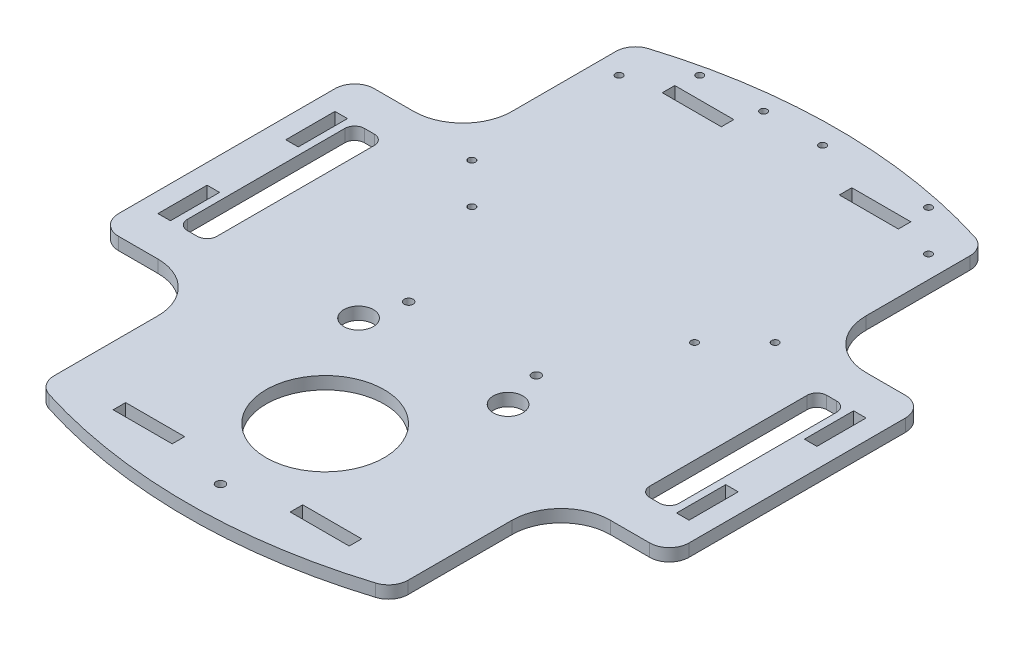
from build123d import *

# Parameters (mm, degrees)
ESQUISSE1_W             = 180
ESQUISSE1_H             = 300
ESQUISSE1_W_2           = 55
ESQUISSE1_H_2           = 130
BOSS_EXTRU_1_DEPTH      = 6.35
CONG_1_R                = 25
CONG_2_R                = 10
ENL_V_MAT_EXTRU_1_REACH = 221.751
ESQUISSE2_R             = 30
ENL_V_MAT_EXTRU_2_REACH = 221.751
ESQUISSE3_R             = 2.25
ENL_V_MAT_EXTRU_3_REACH = 221.751
ESQUISSE5_W             = 30
ESQUISSE5_H             = 6.35
ESQUISSE5_W_2           = 6.35
ESQUISSE5_H_2           = 25
ENL_V_MAT_EXTRU_4_REACH = 221.751
ESQUISSE6_R             = 7.5
ENL_V_MAT_EXTRU_5_REACH = 221.751
ENL_V_MAT_EXTRU_6_REACH = 221.751
ESQUISSE8_R             = 1.8


with BuildPart() as part:
    # Esquisse1 → Boss.-Extru.1 (new body)
    with BuildSketch(Plane(origin=(0, 0, 0), x_dir=(1, 0, 0), z_dir=(0, 1, 0))):
        Rectangle(ESQUISSE1_W, ESQUISSE1_H)
        with Locations((-117.5, 0)):
            Rectangle(ESQUISSE1_W_2, ESQUISSE1_H_2)
        with Locations((117.5, 0)):
            Rectangle(ESQUISSE1_W_2, ESQUISSE1_H_2)
        with BuildLine():
            Line((-90, -150), (90, -150))
            ThreePointArc((90, -150), (0, -165), (-90, -150))
        make_face()
        with BuildLine():
            ThreePointArc((-90, 150), (0, 165), (90, 150))
            Line((90, 150), (-90, 150))
        make_face()
    extrude(amount=BOSS_EXTRU_1_DEPTH)

    # Congé1
    cong_1_edges = [part.edges().sort_by_distance(p)[0] for p in [
        (-90, 3.175, 65),
        (-90, 3.175, -65),
        (90, 3.175, -65),
        (90, 3.175, 65),
    ]]
    fillet(cong_1_edges, radius=CONG_1_R)

    # Congé2
    cong_2_edges = [part.edges().sort_by_distance(p)[0] for p in [
        (-145, 3.175, 65),
        (-145, 3.175, -65),
        (-90, 3.175, -150),
        (90, 3.175, -150),
        (145, 3.175, -65),
        (145, 3.175, 65),
        (90, 3.175, 150),
        (-90, 3.175, 150),
    ]]
    fillet(cong_2_edges, radius=CONG_2_R)

    # Esquisse2 → Enlèv. mat.-Extru.1 (cut, up to next)
    with BuildSketch(Plane(origin=(0, 6.35, 0), x_dir=(1, 0, 0), z_dir=(0, 1, 0)), mode=Mode.PRIVATE) as enl_v_mat_extru_1_sk1:
        with Locations(Location((0, -95, 0), (0, 0, 270))):
            Circle(ESQUISSE2_R)
    enl_v_mat_extru_1_tool1 = extrude(enl_v_mat_extru_1_sk1.sketch, amount=-ENL_V_MAT_EXTRU_1_REACH, mode=Mode.PRIVATE) & part.part
    add(enl_v_mat_extru_1_tool1.solids().sort_by_distance((0, 6.35, 95))[0], mode=Mode.SUBTRACT)

    # Esquisse3 → Enlèv. mat.-Extru.2 (cut, up to next)
    with BuildSketch(Plane(origin=(0, 6.35, 0), x_dir=(1, 0, 0), z_dir=(0, 1, 0)), mode=Mode.PRIVATE) as enl_v_mat_extru_2_sk1:
        with Locations(Location((-32.430740144, -20.063884254, 0), (0, 0, 270))):
            Circle(ESQUISSE3_R)
    enl_v_mat_extru_2_tool1 = extrude(enl_v_mat_extru_2_sk1.sketch, amount=-ENL_V_MAT_EXTRU_2_REACH, mode=Mode.PRIVATE) & part.part
    # Esquisse3 → Enlèv. mat.-Extru.2 (cut, up to next)
    with BuildSketch(Plane(origin=(0, 6.35, 0), x_dir=(1, 0, 0), z_dir=(0, 1, 0)), mode=Mode.PRIVATE) as enl_v_mat_extru_2_sk2:
        with Locations(Location((32.430740144, -20.063884254, 0), (0, 0, 270))):
            Circle(ESQUISSE3_R)
    enl_v_mat_extru_2_tool2 = extrude(enl_v_mat_extru_2_sk2.sketch, amount=-ENL_V_MAT_EXTRU_2_REACH, mode=Mode.PRIVATE) & part.part
    # Esquisse3 → Enlèv. mat.-Extru.2 (cut, up to next)
    with BuildSketch(Plane(origin=(0, 6.35, 0), x_dir=(1, 0, 0), z_dir=(0, 1, 0)), mode=Mode.PRIVATE) as enl_v_mat_extru_2_sk3:
        with Locations(Location((0, -148.187083331, 0), (0, 0, 270))):
            Circle(ESQUISSE3_R)
    enl_v_mat_extru_2_tool3 = extrude(enl_v_mat_extru_2_sk3.sketch, amount=-ENL_V_MAT_EXTRU_2_REACH, mode=Mode.PRIVATE) & part.part
    add(enl_v_mat_extru_2_tool1.solids().sort_by_distance((-32.43074, 6.35, 20.063884))[0], mode=Mode.SUBTRACT)
    add(enl_v_mat_extru_2_tool2.solids().sort_by_distance((32.43074, 6.35, 20.063884))[0], mode=Mode.SUBTRACT)
    add(enl_v_mat_extru_2_tool3.solids().sort_by_distance((0, 6.35, 148.187083))[0], mode=Mode.SUBTRACT)

    # Esquisse5 → Enlèv. mat.-Extru.3 (cut, up to next)
    with BuildSketch(Plane(origin=(0, 6.35, 0), x_dir=(1, 0, 0), z_dir=(0, 1, 0)), mode=Mode.PRIVATE) as enl_v_mat_extru_3_sk1:
        with Locations((-45, 139.582223208)):
            Rectangle(ESQUISSE5_W, ESQUISSE5_H)
    enl_v_mat_extru_3_tool1 = extrude(enl_v_mat_extru_3_sk1.sketch, amount=-ENL_V_MAT_EXTRU_3_REACH, mode=Mode.PRIVATE) & part.part
    # Esquisse5 → Enlèv. mat.-Extru.3 (cut, up to next)
    with BuildSketch(Plane(origin=(0, 6.35, 0), x_dir=(1, 0, 0), z_dir=(0, 1, 0)), mode=Mode.PRIVATE) as enl_v_mat_extru_3_sk2:
        with Locations((45, 139.582223208)):
            Rectangle(ESQUISSE5_W, ESQUISSE5_H)
    enl_v_mat_extru_3_tool2 = extrude(enl_v_mat_extru_3_sk2.sketch, amount=-ENL_V_MAT_EXTRU_3_REACH, mode=Mode.PRIVATE) & part.part
    # Esquisse5 → Enlèv. mat.-Extru.3 (cut, up to next)
    with BuildSketch(Plane(origin=(0, 6.35, 0), x_dir=(1, 0, 0), z_dir=(0, 1, 0)), mode=Mode.PRIVATE) as enl_v_mat_extru_3_sk3:
        with Locations((-45, -139.582223208)):
            Rectangle(ESQUISSE5_W, ESQUISSE5_H)
    enl_v_mat_extru_3_tool3 = extrude(enl_v_mat_extru_3_sk3.sketch, amount=-ENL_V_MAT_EXTRU_3_REACH, mode=Mode.PRIVATE) & part.part
    # Esquisse5 → Enlèv. mat.-Extru.3 (cut, up to next)
    with BuildSketch(Plane(origin=(0, 6.35, 0), x_dir=(1, 0, 0), z_dir=(0, 1, 0)), mode=Mode.PRIVATE) as enl_v_mat_extru_3_sk4:
        with Locations((45, -139.582223208)):
            Rectangle(ESQUISSE5_W, ESQUISSE5_H)
    enl_v_mat_extru_3_tool4 = extrude(enl_v_mat_extru_3_sk4.sketch, amount=-ENL_V_MAT_EXTRU_3_REACH, mode=Mode.PRIVATE) & part.part
    # Esquisse5 → Enlèv. mat.-Extru.3 (cut, up to next)
    with BuildSketch(Plane(origin=(0, 6.35, 0), x_dir=(1, 0, 0), z_dir=(0, 1, 0)), mode=Mode.PRIVATE) as enl_v_mat_extru_3_sk5:
        with Locations((131.825, -32.5)):
            Rectangle(ESQUISSE5_W_2, ESQUISSE5_H_2)
    enl_v_mat_extru_3_tool5 = extrude(enl_v_mat_extru_3_sk5.sketch, amount=-ENL_V_MAT_EXTRU_3_REACH, mode=Mode.PRIVATE) & part.part
    # Esquisse5 → Enlèv. mat.-Extru.3 (cut, up to next)
    with BuildSketch(Plane(origin=(0, 6.35, 0), x_dir=(1, 0, 0), z_dir=(0, 1, 0)), mode=Mode.PRIVATE) as enl_v_mat_extru_3_sk6:
        with Locations((131.825, 32.5)):
            Rectangle(ESQUISSE5_W_2, ESQUISSE5_H_2)
    enl_v_mat_extru_3_tool6 = extrude(enl_v_mat_extru_3_sk6.sketch, amount=-ENL_V_MAT_EXTRU_3_REACH, mode=Mode.PRIVATE) & part.part
    # Esquisse5 → Enlèv. mat.-Extru.3 (cut, up to next)
    with BuildSketch(Plane(origin=(0, 6.35, 0), x_dir=(1, 0, 0), z_dir=(0, 1, 0)), mode=Mode.PRIVATE) as enl_v_mat_extru_3_sk7:
        with Locations((-131.825, 32.5)):
            Rectangle(ESQUISSE5_W_2, ESQUISSE5_H_2)
    enl_v_mat_extru_3_tool7 = extrude(enl_v_mat_extru_3_sk7.sketch, amount=-ENL_V_MAT_EXTRU_3_REACH, mode=Mode.PRIVATE) & part.part
    # Esquisse5 → Enlèv. mat.-Extru.3 (cut, up to next)
    with BuildSketch(Plane(origin=(0, 6.35, 0), x_dir=(1, 0, 0), z_dir=(0, 1, 0)), mode=Mode.PRIVATE) as enl_v_mat_extru_3_sk8:
        with Locations((-131.825, -32.5)):
            Rectangle(ESQUISSE5_W_2, ESQUISSE5_H_2)
    enl_v_mat_extru_3_tool8 = extrude(enl_v_mat_extru_3_sk8.sketch, amount=-ENL_V_MAT_EXTRU_3_REACH, mode=Mode.PRIVATE) & part.part
    add(enl_v_mat_extru_3_tool1.solids().sort_by_distance((-45, 6.35, -139.582223))[0], mode=Mode.SUBTRACT)
    add(enl_v_mat_extru_3_tool2.solids().sort_by_distance((45, 6.35, -139.582223))[0], mode=Mode.SUBTRACT)
    add(enl_v_mat_extru_3_tool3.solids().sort_by_distance((-45, 6.35, 139.582223))[0], mode=Mode.SUBTRACT)
    add(enl_v_mat_extru_3_tool4.solids().sort_by_distance((45, 6.35, 139.582223))[0], mode=Mode.SUBTRACT)
    add(enl_v_mat_extru_3_tool5.solids().sort_by_distance((131.825, 6.35, 32.5))[0], mode=Mode.SUBTRACT)
    add(enl_v_mat_extru_3_tool6.solids().sort_by_distance((131.825, 6.35, -32.5))[0], mode=Mode.SUBTRACT)
    add(enl_v_mat_extru_3_tool7.solids().sort_by_distance((-131.825, 6.35, -32.5))[0], mode=Mode.SUBTRACT)
    add(enl_v_mat_extru_3_tool8.solids().sort_by_distance((-131.825, 6.35, 32.5))[0], mode=Mode.SUBTRACT)

    # Esquisse6 → Enlèv. mat.-Extru.4 (cut, up to next)
    with BuildSketch(Plane(origin=(0, 6.35, 0), x_dir=(1, 0, 0), z_dir=(0, 1, 0)), mode=Mode.PRIVATE) as enl_v_mat_extru_4_sk1:
        with Locations(Location((38, -40, 0), (0, 0, 270))):
            Circle(ESQUISSE6_R)
    enl_v_mat_extru_4_tool1 = extrude(enl_v_mat_extru_4_sk1.sketch, amount=-ENL_V_MAT_EXTRU_4_REACH, mode=Mode.PRIVATE) & part.part
    # Esquisse6 → Enlèv. mat.-Extru.4 (cut, up to next)
    with BuildSketch(Plane(origin=(0, 6.35, 0), x_dir=(1, 0, 0), z_dir=(0, 1, 0)), mode=Mode.PRIVATE) as enl_v_mat_extru_4_sk2:
        with Locations(Location((-38, -40, 0), (0, 0, 270))):
            Circle(ESQUISSE6_R)
    enl_v_mat_extru_4_tool2 = extrude(enl_v_mat_extru_4_sk2.sketch, amount=-ENL_V_MAT_EXTRU_4_REACH, mode=Mode.PRIVATE) & part.part
    add(enl_v_mat_extru_4_tool1.solids().sort_by_distance((38, 6.35, 40))[0], mode=Mode.SUBTRACT)
    add(enl_v_mat_extru_4_tool2.solids().sort_by_distance((-38, 6.35, 40))[0], mode=Mode.SUBTRACT)

    # Esquisse7 → Enlèv. mat.-Extru.5 (cut, up to next)
    with BuildSketch(Plane(origin=(0, 6.35, 0), x_dir=(1, 0, 0), z_dir=(0, 1, 0)), mode=Mode.PRIVATE) as enl_v_mat_extru_5_sk1:
        with BuildLine():
            Line((-120, 45), (-115, 45))
            ThreePointArc((-115, 45), (-111.464466094, 43.535533906), (-110, 40))
            Line((-110, 40), (-110, -40))
            ThreePointArc((-110, -40), (-111.464466094, -43.535533906), (-115, -45))
            Line((-115, -45), (-120, -45))
            ThreePointArc((-120, -45), (-123.535533906, -43.535533906), (-125, -40))
            Line((-125, -40), (-125, 40))
            ThreePointArc((-125, 40), (-123.535533906, 43.535533906), (-120, 45))
        make_face()
    enl_v_mat_extru_5_tool1 = extrude(enl_v_mat_extru_5_sk1.sketch, amount=-ENL_V_MAT_EXTRU_5_REACH, mode=Mode.PRIVATE) & part.part
    # Esquisse7 → Enlèv. mat.-Extru.5 (cut, up to next)
    with BuildSketch(Plane(origin=(0, 6.35, 0), x_dir=(1, 0, 0), z_dir=(0, 1, 0)), mode=Mode.PRIVATE) as enl_v_mat_extru_5_sk2:
        with BuildLine():
            Line((120, -45), (115, -45))
            ThreePointArc((115, -45), (111.464466094, -43.535533906), (110, -40))
            Line((110, -40), (110, 40))
            ThreePointArc((110, 40), (111.464466094, 43.535533906), (115, 45))
            Line((115, 45), (120, 45))
            ThreePointArc((120, 45), (123.535533906, 43.535533906), (125, 40))
            Line((125, 40), (125, -40))
            ThreePointArc((125, -40), (123.535533906, -43.535533906), (120, -45))
        make_face()
    enl_v_mat_extru_5_tool2 = extrude(enl_v_mat_extru_5_sk2.sketch, amount=-ENL_V_MAT_EXTRU_5_REACH, mode=Mode.PRIVATE) & part.part
    add(enl_v_mat_extru_5_tool1.solids().sort_by_distance((-117.5, 6.35, 0))[0], mode=Mode.SUBTRACT)
    add(enl_v_mat_extru_5_tool2.solids().sort_by_distance((117.5, 6.35, 0))[0], mode=Mode.SUBTRACT)

    # Esquisse8 → Enlèv. mat.-Extru.6 (cut, up to next)
    with BuildSketch(Plane(origin=(0, 6.35, 0), x_dir=(1, 0, 0), z_dir=(0, 1, 0)), mode=Mode.PRIVATE) as enl_v_mat_extru_6_sk1:
        with Locations(Location((-78.714587663, 58.315573098, 0), (0, 0, 270))):
            Circle(ESQUISSE8_R)
    enl_v_mat_extru_6_tool1 = extrude(enl_v_mat_extru_6_sk1.sketch, amount=-ENL_V_MAT_EXTRU_6_REACH, mode=Mode.PRIVATE) & part.part
    # Esquisse8 → Enlèv. mat.-Extru.6 (cut, up to next)
    with BuildSketch(Plane(origin=(0, 6.35, 0), x_dir=(1, 0, 0), z_dir=(0, 1, 0)), mode=Mode.PRIVATE) as enl_v_mat_extru_6_sk2:
        with Locations(Location((-58.214587663, 37.815573098, 0), (0, 0, 270))):
            Circle(ESQUISSE8_R)
    enl_v_mat_extru_6_tool2 = extrude(enl_v_mat_extru_6_sk2.sketch, amount=-ENL_V_MAT_EXTRU_6_REACH, mode=Mode.PRIVATE) & part.part
    # Esquisse8 → Enlèv. mat.-Extru.6 (cut, up to next)
    with BuildSketch(Plane(origin=(0, 6.35, 0), x_dir=(1, 0, 0), z_dir=(0, 1, 0)), mode=Mode.PRIVATE) as enl_v_mat_extru_6_sk3:
        with Locations(Location((58.171926902, 34.640573098, 0), (0, 0, 270))):
            Circle(ESQUISSE8_R)
    enl_v_mat_extru_6_tool3 = extrude(enl_v_mat_extru_6_sk3.sketch, amount=-ENL_V_MAT_EXTRU_6_REACH, mode=Mode.PRIVATE) & part.part
    # Esquisse8 → Enlèv. mat.-Extru.6 (cut, up to next)
    with BuildSketch(Plane(origin=(0, 6.35, 0), x_dir=(1, 0, 0), z_dir=(0, 1, 0)), mode=Mode.PRIVATE) as enl_v_mat_extru_6_sk4:
        with Locations(Location((78.671926902, 55.140573098, 0), (0, 0, 270))):
            Circle(ESQUISSE8_R)
    enl_v_mat_extru_6_tool4 = extrude(enl_v_mat_extru_6_sk4.sketch, amount=-ENL_V_MAT_EXTRU_6_REACH, mode=Mode.PRIVATE) & part.part
    # Esquisse8 → Enlèv. mat.-Extru.6 (cut, up to next)
    with BuildSketch(Plane(origin=(0, 6.35, 0), x_dir=(1, 0, 0), z_dir=(0, 1, 0)), mode=Mode.PRIVATE) as enl_v_mat_extru_6_sk5:
        with Locations(Location((78.671926902, 133.090573098, 0), (0, 0, 270))):
            Circle(ESQUISSE8_R)
    enl_v_mat_extru_6_tool5 = extrude(enl_v_mat_extru_6_sk5.sketch, amount=-ENL_V_MAT_EXTRU_6_REACH, mode=Mode.PRIVATE) & part.part
    # Esquisse8 → Enlèv. mat.-Extru.6 (cut, up to next)
    with BuildSketch(Plane(origin=(0, 6.35, 0), x_dir=(1, 0, 0), z_dir=(0, 1, 0)), mode=Mode.PRIVATE) as enl_v_mat_extru_6_sk6:
        with Locations(Location((58.171926902, 153.590573098, 0), (0, 0, 270))):
            Circle(ESQUISSE8_R)
    enl_v_mat_extru_6_tool6 = extrude(enl_v_mat_extru_6_sk6.sketch, amount=-ENL_V_MAT_EXTRU_6_REACH, mode=Mode.PRIVATE) & part.part
    # Esquisse8 → Enlèv. mat.-Extru.6 (cut, up to next)
    with BuildSketch(Plane(origin=(0, 6.35, 0), x_dir=(1, 0, 0), z_dir=(0, 1, 0)), mode=Mode.PRIVATE) as enl_v_mat_extru_6_sk7:
        with Locations(Location((3.8875, 154, 0), (0, 0, 270))):
            Circle(ESQUISSE8_R)
    enl_v_mat_extru_6_tool7 = extrude(enl_v_mat_extru_6_sk7.sketch, amount=-ENL_V_MAT_EXTRU_6_REACH, mode=Mode.PRIVATE) & part.part
    # Esquisse8 → Enlèv. mat.-Extru.6 (cut, up to next)
    with BuildSketch(Plane(origin=(0, 6.35, 0), x_dir=(1, 0, 0), z_dir=(0, 1, 0)), mode=Mode.PRIVATE) as enl_v_mat_extru_6_sk8:
        with Locations(Location((-26.1125, 154, 0), (0, 0, 270))):
            Circle(ESQUISSE8_R)
    enl_v_mat_extru_6_tool8 = extrude(enl_v_mat_extru_6_sk8.sketch, amount=-ENL_V_MAT_EXTRU_6_REACH, mode=Mode.PRIVATE) & part.part
    # Esquisse8 → Enlèv. mat.-Extru.6 (cut, up to next)
    with BuildSketch(Plane(origin=(0, 6.35, 0), x_dir=(1, 0, 0), z_dir=(0, 1, 0)), mode=Mode.PRIVATE) as enl_v_mat_extru_6_sk9:
        with Locations(Location((-58.171926902, 153.590573098, 0), (0, 0, 270))):
            Circle(ESQUISSE8_R)
    enl_v_mat_extru_6_tool9 = extrude(enl_v_mat_extru_6_sk9.sketch, amount=-ENL_V_MAT_EXTRU_6_REACH, mode=Mode.PRIVATE) & part.part
    # Esquisse8 → Enlèv. mat.-Extru.6 (cut, up to next)
    with BuildSketch(Plane(origin=(0, 6.35, 0), x_dir=(1, 0, 0), z_dir=(0, 1, 0)), mode=Mode.PRIVATE) as enl_v_mat_extru_6_sk10:
        with Locations(Location((-78.671926902, 133.090573098, 0), (0, 0, 270))):
            Circle(ESQUISSE8_R)
    enl_v_mat_extru_6_tool10 = extrude(enl_v_mat_extru_6_sk10.sketch, amount=-ENL_V_MAT_EXTRU_6_REACH, mode=Mode.PRIVATE) & part.part
    add(enl_v_mat_extru_6_tool1.solids().sort_by_distance((-78.714588, 6.35, -58.315573))[0], mode=Mode.SUBTRACT)
    add(enl_v_mat_extru_6_tool2.solids().sort_by_distance((-58.214588, 6.35, -37.815573))[0], mode=Mode.SUBTRACT)
    add(enl_v_mat_extru_6_tool3.solids().sort_by_distance((58.171927, 6.35, -34.640573))[0], mode=Mode.SUBTRACT)
    add(enl_v_mat_extru_6_tool4.solids().sort_by_distance((78.671927, 6.35, -55.140573))[0], mode=Mode.SUBTRACT)
    add(enl_v_mat_extru_6_tool5.solids().sort_by_distance((78.671927, 6.35, -133.090573))[0], mode=Mode.SUBTRACT)
    add(enl_v_mat_extru_6_tool6.solids().sort_by_distance((58.171927, 6.35, -153.590573))[0], mode=Mode.SUBTRACT)
    add(enl_v_mat_extru_6_tool7.solids().sort_by_distance((3.8875, 6.35, -154))[0], mode=Mode.SUBTRACT)
    add(enl_v_mat_extru_6_tool8.solids().sort_by_distance((-26.1125, 6.35, -154))[0], mode=Mode.SUBTRACT)
    add(enl_v_mat_extru_6_tool9.solids().sort_by_distance((-58.171927, 6.35, -153.590573))[0], mode=Mode.SUBTRACT)
    add(enl_v_mat_extru_6_tool10.solids().sort_by_distance((-78.671927, 6.35, -133.090573))[0], mode=Mode.SUBTRACT)


solid = part.part
